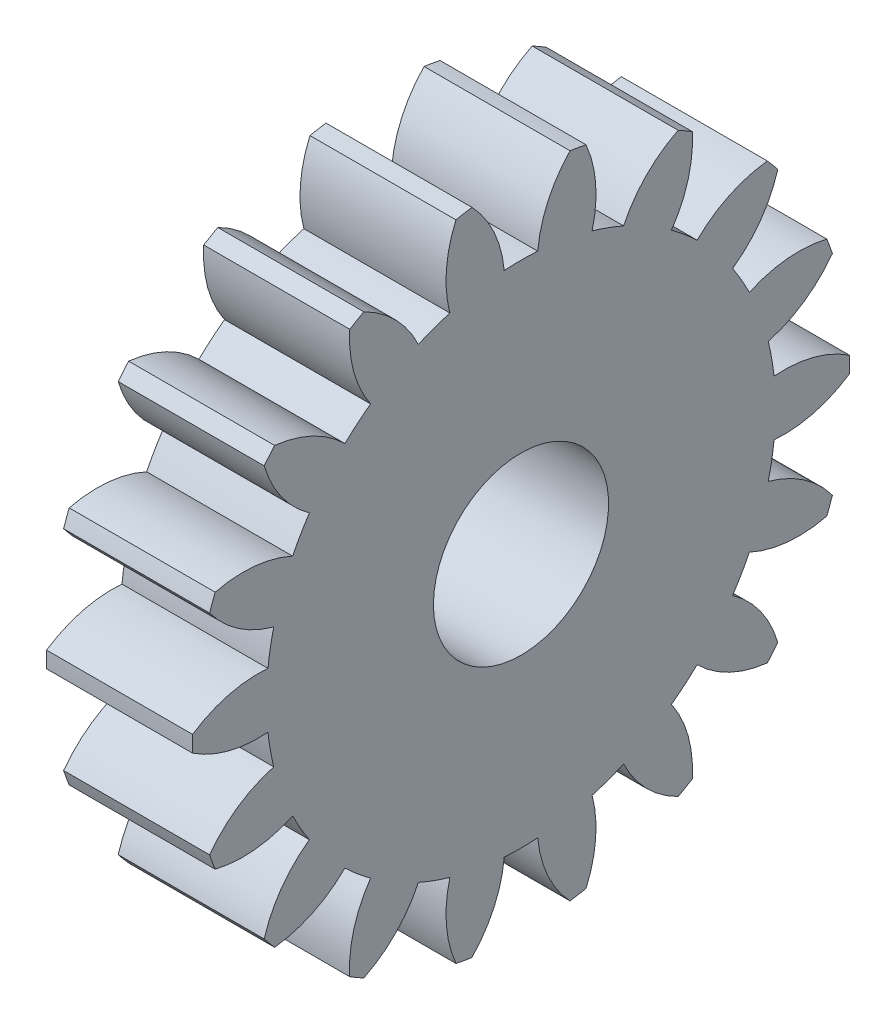
from build123d import *

# Parameters (mm, degrees)
BASPROSKE_W     = 5
BASPROSKE_H     = 11.25
TOOTHCUT_DEPTH  = 17.67708008
TEETHCUTS_COUNT = 18
TEETHCUTS_ANGLE = 340
BORSKE_R        = 3
BORE_DEPTH      = 50.0000508


with BuildPart() as part:
    # BasProSke → Base-Revolve (revolve)
    with BuildSketch(Plane(origin=(0, 0, 0), x_dir=(1, 0, 0), z_dir=(0, 1, 0)), mode=Mode.PRIVATE) as base_revolve_sk:
        with Locations((2.5, 5.625)):
            Rectangle(BASPROSKE_W, BASPROSKE_H)
    revolve(base_revolve_sk.sketch.rotate(Axis((-10, 0, 0), (1, 0, 0)), 180), axis=Axis((-10, 0, 0), (1, 0, 0)))

    # TooCutSke → ToothCut (cut, through all)
    with BuildSketch(Plane(origin=(0, 0, 0), x_dir=(0, 0, -1), z_dir=(1, 0, 0))):
        with BuildLine():
            ThreePointArc((0.573352044, 8.698875358), (0, 8.71775), (-0.573352044, 8.698875358))
            ThreePointArc((-0.573352044, 8.698875358), (-0.927373593, 10.019142299), (-1.700441513, 11.146440859))
            ThreePointArc((-1.700441513, 11.146440859), (0, 11.2754), (1.700441513, 11.146440859))
            ThreePointArc((1.700441513, 11.146440859), (0.927373593, 10.019142299), (0.573352044, 8.698875358))
        make_face()
    toothcut = extrude(amount=TOOTHCUT_DEPTH, mode=Mode.SUBTRACT)

    # TeethCuts: ToothCut ×18 about axis
    teethcuts_axis = Axis((-10, 0, 0), (1, 0, 0))
    for i in range(1, TEETHCUTS_COUNT):
        add(toothcut.rotate(teethcuts_axis, i * TEETHCUTS_ANGLE / (TEETHCUTS_COUNT - 1)), mode=Mode.SUBTRACT)

    # BorSke → Bore (cut, symmetric)
    with BuildSketch(Plane(origin=(0, 0, 0), x_dir=(0, 0, -1), z_dir=(1, 0, 0))):
        with Locations(Location((0, 0, 0), (0, 0, 180))):
            Circle(BORSKE_R)
    extrude(amount=BORE_DEPTH, both=True, mode=Mode.SUBTRACT)


solid = part.part
